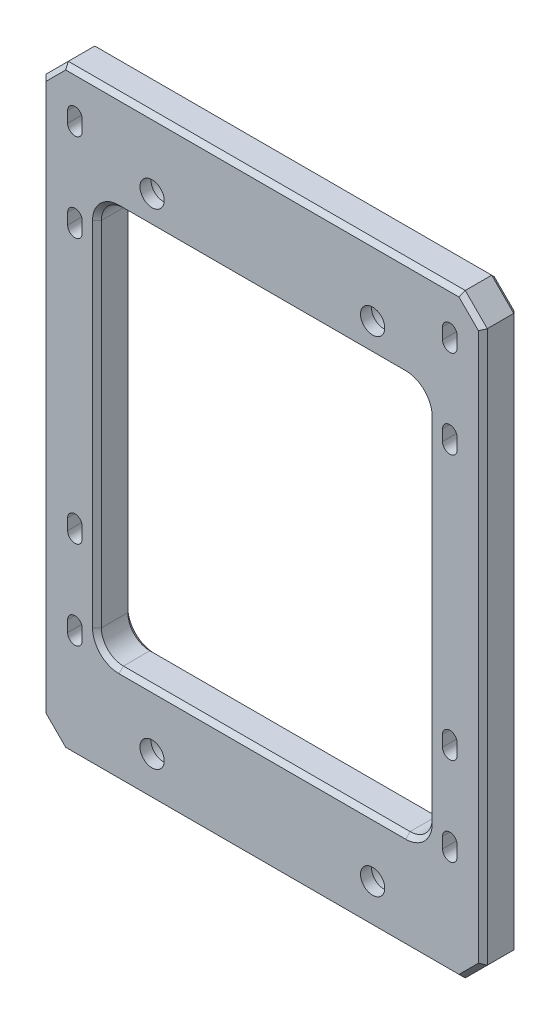
from build123d import *

# Parameters (mm, degrees)
SKETCH_1_W                = 200
SKETCH_1_H                = 270
EXTRUDE_1_DEPTH           = 16
HOLE_WIZARD_1_D           = 11
HOLE_WIZARD_1_CBORE_D     = 18
HOLE_WIZARD_1_CBORE_DEPTH = 11
CUT_EXTRUDE_1_DEPTH       = 169.763147636
SKETCH_5_W                = 150
SKETCH_5_H                = 180
CUT_EXTRUDE_2_DEPTH       = 169.763147636
FILLET_1_R                = 10
CHAMFER_1_SIZE            = 10
CHAMFER_2_SIZE            = 2


with BuildPart() as part:
    # 草图1 → 凸台-拉伸1 (new body)
    with BuildSketch(Plane.XY):
        Rectangle(SKETCH_1_W, SKETCH_1_H)
    extrude(amount=EXTRUDE_1_DEPTH)

    # 打孔尺寸(%根据)内六角圆柱头螺钉的类型1 (through all)
    with Locations(Plane(origin=(0, 0, 0), x_dir=(-1, 0, 0), z_dir=(0, 0, -1))):
        with Locations((-50, -116), (50, -116), (-50, 104), (50, 104)):
            CounterBoreHole(HOLE_WIZARD_1_D / 2, HOLE_WIZARD_1_CBORE_D / 2, HOLE_WIZARD_1_CBORE_DEPTH)

    # 草图4 → 切除-拉伸1 (cut, through all)
    with BuildSketch(Plane.XY.offset(16)):
        with BuildLine():
            Line((-88.3, 112.5), (-88.3, 117.5))
            ThreePointArc((-88.3, 117.5), (-85, 120.8), (-81.7, 117.5))
            Line((-81.7, 117.5), (-81.7, 112.5))
            ThreePointArc((-81.7, 112.5), (-85, 109.2), (-88.3, 112.5))
        make_face()
        with BuildLine():
            Line((81.7, 112.5), (81.7, 117.5))
            ThreePointArc((81.7, 117.5), (85, 120.8), (88.3, 117.5))
            Line((88.3, 117.5), (88.3, 112.5))
            ThreePointArc((88.3, 112.5), (85, 109.2), (81.7, 112.5))
        make_face()
        with BuildLine():
            Line((81.7, 72.5), (81.7, 77.5))
            ThreePointArc((81.7, 77.5), (85, 80.8), (88.3, 77.5))
            Line((88.3, 77.5), (88.3, 72.5))
            ThreePointArc((88.3, 72.5), (85, 69.2), (81.7, 72.5))
        make_face()
        with BuildLine():
            Line((-88.3, 72.5), (-88.3, 77.5))
            ThreePointArc((-88.3, 77.5), (-85, 80.8), (-81.7, 77.5))
            Line((-81.7, 77.5), (-81.7, 72.5))
            ThreePointArc((-81.7, 72.5), (-85, 69.2), (-88.3, 72.5))
        make_face()
        with BuildLine():
            Line((-88.3, -47.5), (-88.3, -42.5))
            ThreePointArc((-88.3, -42.5), (-85, -39.2), (-81.7, -42.5))
            Line((-81.7, -42.5), (-81.7, -47.5))
            ThreePointArc((-81.7, -47.5), (-85, -50.8), (-88.3, -47.5))
        make_face()
        with BuildLine():
            Line((-88.3, -87.5), (-88.3, -82.5))
            ThreePointArc((-88.3, -82.5), (-85, -79.2), (-81.7, -82.5))
            Line((-81.7, -82.5), (-81.7, -87.5))
            ThreePointArc((-81.7, -87.5), (-85, -90.8), (-88.3, -87.5))
        make_face()
        with BuildLine():
            Line((81.7, -47.5), (81.7, -42.5))
            ThreePointArc((81.7, -42.5), (85, -39.2), (88.3, -42.5))
            Line((88.3, -42.5), (88.3, -47.5))
            ThreePointArc((88.3, -47.5), (85, -50.8), (81.7, -47.5))
        make_face()
        with BuildLine():
            Line((81.7, -87.5), (81.7, -82.5))
            ThreePointArc((81.7, -82.5), (85, -79.2), (88.3, -82.5))
            Line((88.3, -82.5), (88.3, -87.5))
            ThreePointArc((88.3, -87.5), (85, -90.8), (81.7, -87.5))
        make_face()
    extrude(amount=-CUT_EXTRUDE_1_DEPTH, mode=Mode.SUBTRACT)

    # 草图5 → 切除-拉伸2 (cut, through all)
    with BuildSketch(Plane(origin=(0, 0, 0), x_dir=(-1, 0, 0), z_dir=(0, 0, -1))):
        Rectangle(SKETCH_5_W, SKETCH_5_H)
    extrude(amount=-CUT_EXTRUDE_2_DEPTH, mode=Mode.SUBTRACT)

    # 圆角1
    fillet_1_edges = [part.edges().sort_by_distance(p)[0] for p in [
        (75, -90, 8),
        (75, 90, 8),
        (-75, 90, 8),
        (-75, -90, 8),
    ]]
    fillet(fillet_1_edges, radius=FILLET_1_R)

    # 倒角1
    chamfer_1_edges = [part.edges().sort_by_distance(p)[0] for p in [
        (100, -135, 8),
        (-100, -135, 8),
        (-100, 135, 8),
        (100, 135, 8),
    ]]
    chamfer(chamfer_1_edges, length=CHAMFER_1_SIZE)

    # 倒角2
    chamfer_2_edges = [part.edges().sort_by_distance(p)[0] for p in [
        (0, 90, 0),
        (0, 90, 16),
        (-75, 0, 0),
        (-75, 0, 16),
        (75, 0, 0),
        (75, 0, 16),
        (0, -90, 0),
        (0, -90, 16),
        (-72.071067812, 87.071067812, 0),
        (-72.071067812, 87.071067812, 16),
        (72.071067812, 87.071067812, 0),
        (72.071067812, 87.071067812, 16),
        (-72.071067812, -87.071067812, 0),
        (-72.071067812, -87.071067812, 16),
        (72.071067812, -87.071067812, 0),
        (72.071067812, -87.071067812, 16),
        (100, 0, 0),
        (100, 0, 16),
        (0, -135, 0),
        (-100, 0, 0),
        (0, 135, 0),
        (-95, -130, 0),
        (-95, 130, 0),
        (95, 130, 0),
        (95, -130, 0),
        (0, -135, 16),
        (0, 135, 16),
        (-100, 0, 16),
        (-95, -130, 16),
        (-95, 130, 16),
        (95, 130, 16),
        (95, -130, 16),
    ]]
    chamfer(chamfer_2_edges, length=CHAMFER_2_SIZE)


solid = part.part
